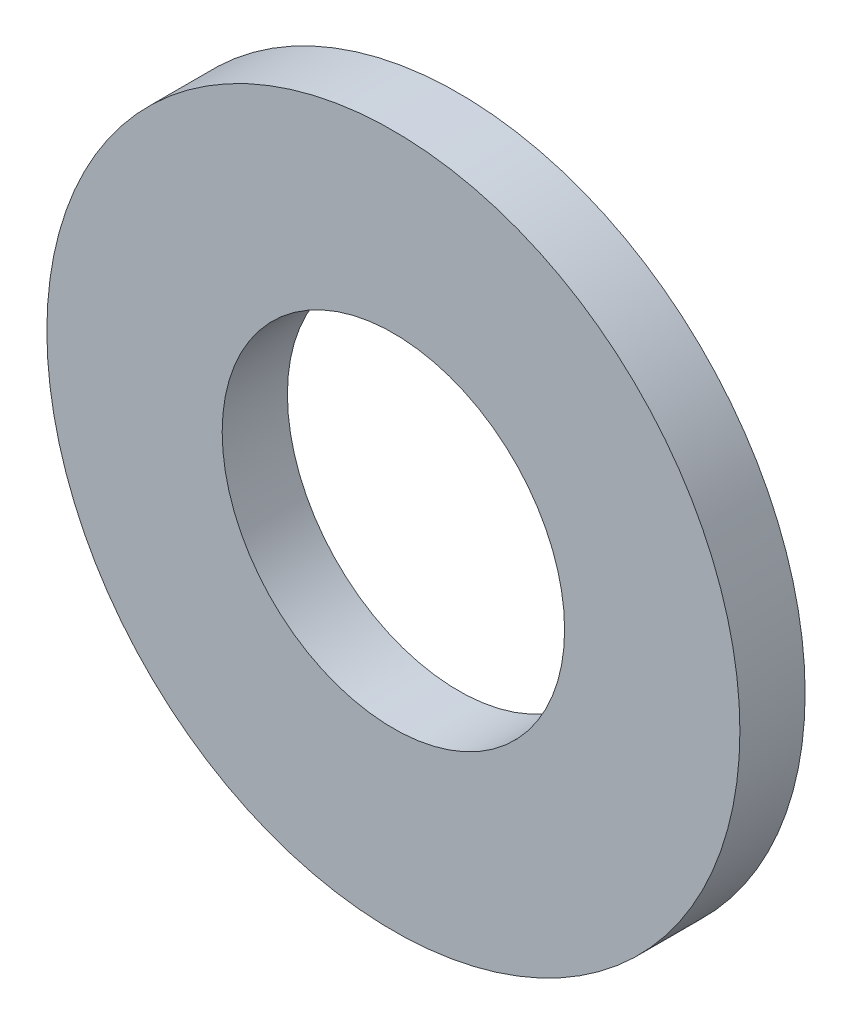
from build123d import *

# Parameters (mm, degrees)
SKETCH_1_R      = 8.5
SKETCH_1_R_2    = 4.2
EXTRUDE_1_DEPTH = 1.6


with BuildPart() as part:
    # Эскиз1 → Вытянуть1 (new body)
    with BuildSketch(Plane.XY):
        Circle(SKETCH_1_R)
        Circle(SKETCH_1_R_2, mode=Mode.SUBTRACT)
    extrude(amount=EXTRUDE_1_DEPTH)


solid = part.part
